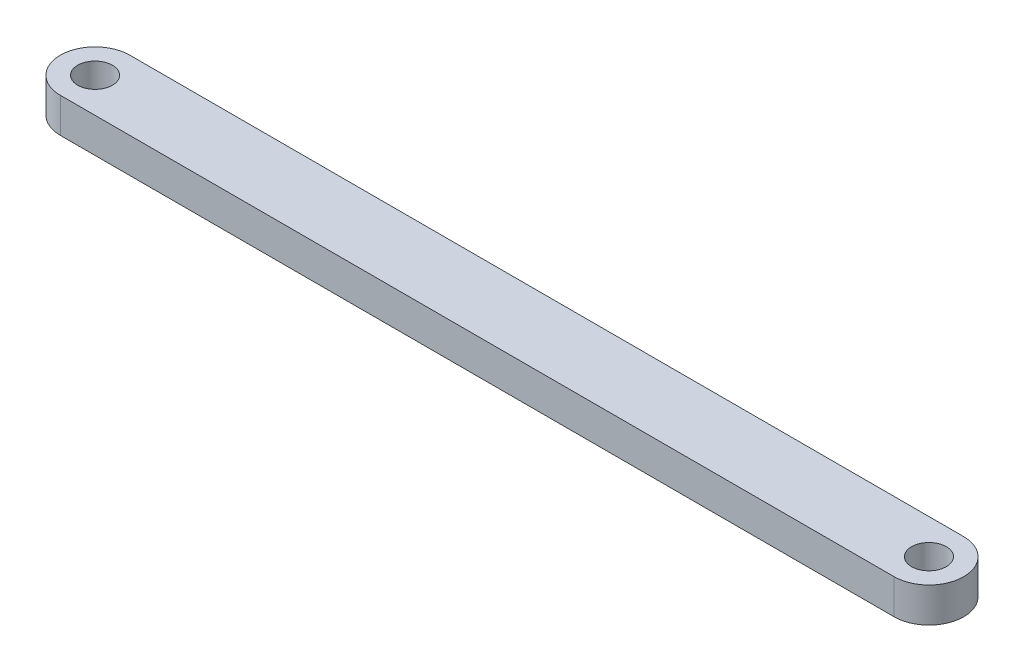
from build123d import *

# Parameters (mm, degrees)
SKETCH2_R           = 2.5
BOSS_EXTRUDE1_DEPTH = 5


with BuildPart() as part:
    # Sketch2 → Boss-Extrude1 (new body)
    with BuildSketch(Plane(origin=(0, 0, 0), x_dir=(1, 0, 0), z_dir=(0, 1, 0))):
        with BuildLine():
            Line((60, -5), (-60, -5))
            ThreePointArc((-60, -5), (-65, 0), (-60, 5))
            Line((-60, 5), (60, 5))
            ThreePointArc((60, 5), (65, 0), (60, -5))
        make_face()
        with Locations(Location((60, 0, 0), (0, 0, 270))):
            Circle(SKETCH2_R, mode=Mode.SUBTRACT)
        with Locations(Location((-60, 0, 0), (0, 0, 270))):
            Circle(SKETCH2_R, mode=Mode.SUBTRACT)
    extrude(amount=BOSS_EXTRUDE1_DEPTH)


solid = part.part
